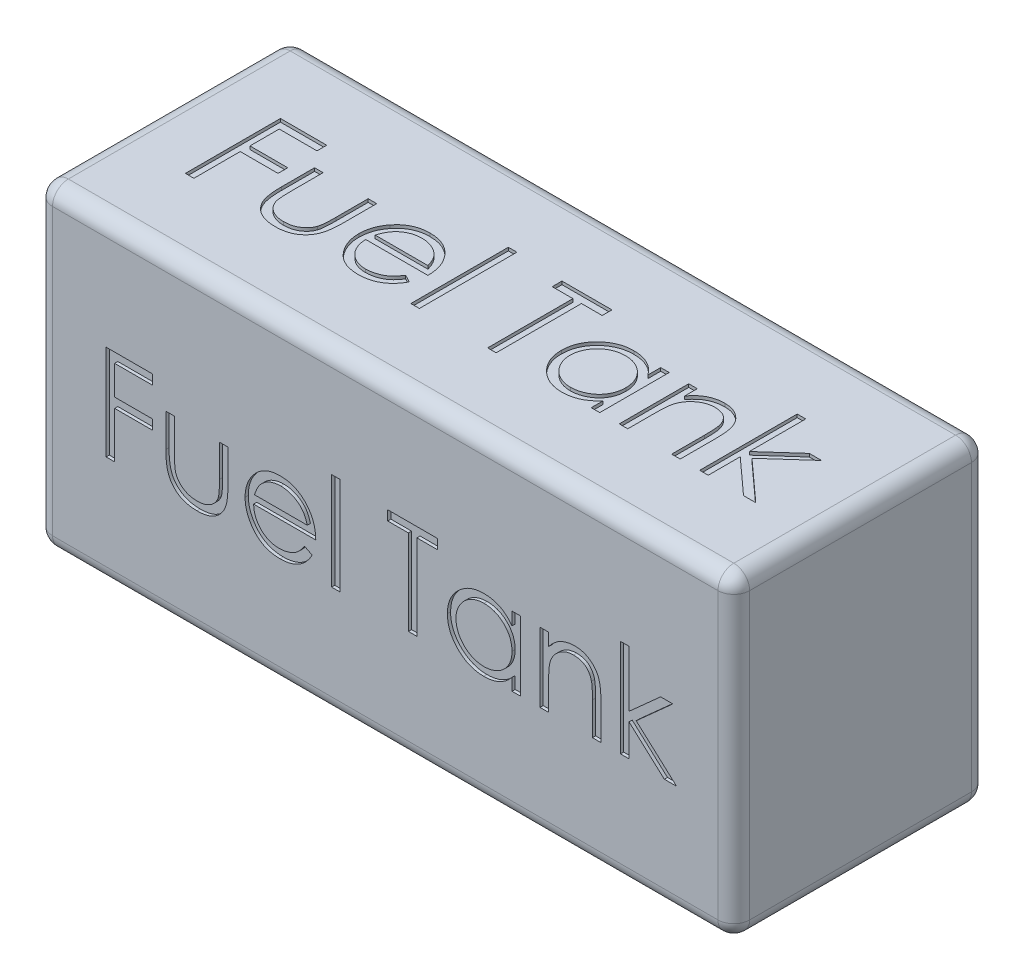
from build123d import *

# Parameters (mm, degrees)
SKETCH2_W           = 220
SKETCH2_H           = 80
BOSS_EXTRUDE1_DEPTH = 50
SKETCH3_W           = 2.692307692
SKETCH3_H           = 30.769230769
CUT_EXTRUDE1_DEPTH  = 1
SKETCH4_W           = 2.692307692
SKETCH4_H           = 30.769230769
CUT_EXTRUDE2_DEPTH  = 1
SKETCH5_W           = 2.692307692
SKETCH5_H           = 30.769230769
CUT_EXTRUDE3_DEPTH  = 1
FILLET1_R           = 5


with BuildPart() as part:
    # Sketch2 → Boss-Extrude1 (new, symmetric)
    with BuildSketch(Plane(origin=(0, 0, 0), x_dir=(1, 0, 0), z_dir=(0, 1, 0))):
        Rectangle(SKETCH2_W, SKETCH2_H)
    extrude(amount=BOSS_EXTRUDE1_DEPTH, both=True)

    # Sketch3 → Cut-Extrude1 (cut)
    # profile 1 of 8: a face of its own
    with BuildSketch(Plane(origin=(0, 50, 0), x_dir=(1, 0, 0), z_dir=(0, 1, 0))):
        Polygon((-88.076923077, 15), (-73.461538462, 15), (-73.461538462, 11.923076923), (-85.384615385, 11.923076923), (-85.384615385, 2.692307692), (-73.461538462, 2.692307692), (-73.461538462, -0.384615385), (-85.384615385, -0.384615385), (-85.384615385, -15), (-88.076923077, -15), align=None)
    # profile 2 of 8: a face of its own
    with BuildSketch(Plane(origin=(0, 50, 0), x_dir=(1, 0, 0), z_dir=(0, 1, 0))):
        with BuildLine():
            Line((-69.230769231, 6.923076923), (-66.538461538, 6.923076923))
            Line((-66.538461538, 6.923076923), (-66.538461538, -3.245192308))
            add(Edge.make_bspline(
                [(-66.538461538, -3.245192308), (-66.537245211, -3.543673015), (-66.534918433, -4.114652627), (-66.519138939, -4.936268513), (-66.482023851, -5.685554622), (-66.435619641, -6.362943794), (-66.375944188, -6.968321436), (-66.304943955, -7.499573068), (-66.225586056, -7.962723217), (-66.14790565, -8.241666266), (-66.111778846, -8.371394231)],
                knots=[0, 0, 0, 0, 1.388932606, 2.656963016, 3.823490214, 4.879454478, 5.816252168, 6.653371382, 7.373723809, 8, 8, 8, 8], degree=3))
            add(Edge.make_bspline(
                [(-66.111778846, -8.371394231), (-66.053823517, -8.534447411), (-65.939117737, -8.857163934), (-65.731059305, -9.323355407), (-65.473673563, -9.755143542), (-65.192017896, -10.169178451), (-64.86716583, -10.553195482), (-64.503227506, -10.906546142), (-64.112385475, -11.242581209), (-63.531628132, -11.640165141), (-62.737405852, -12.066296542), (-61.694667949, -12.433974985), (-60.564060299, -12.653710585), (-59.782648419, -12.6792042), (-59.381009615, -12.692307692)],
                knots=[0, 0, 0, 0, 0.725840625, 1.436591201, 2.137033971, 2.831655856, 3.53531722, 4.242432219, 4.957935707, 5.694543706, 7.190802206, 8.724350549, 10.316345118, 12, 12, 12, 12], degree=3))
            add(Edge.make_bspline(
                [(-59.381009615, -12.692307692), (-58.979408121, -12.678925561), (-58.202383535, -12.653033614), (-57.084198084, -12.440603283), (-56.062043103, -12.085697378), (-55.146177807, -11.590205277), (-54.340756319, -10.983844738), (-53.669575587, -10.272340663), (-53.11579912, -9.478203061), (-52.874004086, -8.885709243), (-52.752403846, -8.587740385)],
                knots=[0, 0, 0, 0, 1.157059328, 2.238695713, 3.266970494, 4.264342957, 5.228770407, 6.160125903, 7.074715775, 8, 8, 8, 8], degree=3))
            add(Edge.make_bspline(
                [(-52.752403846, -8.587740385), (-52.716453303, -8.468029253), (-52.636975431, -8.203377178), (-52.551583847, -7.754407906), (-52.47465989, -7.21899701), (-52.408975523, -6.593640936), (-52.362131272, -5.879973915), (-52.336879616, -5.078218976), (-52.308351543, -4.190893032), (-52.307918546, -3.569740809), (-52.307692308, -3.245192308)],
                knots=[0, 0, 0, 0, 0.557542046, 1.232589297, 2.036731608, 2.971723315, 4.038036528, 5.22795436, 6.551621927, 8, 8, 8, 8], degree=3))
            Line((-52.307692308, -3.245192308), (-52.307692308, 6.923076923))
            Line((-52.307692308, 6.923076923), (-49.615384615, 6.923076923))
            Line((-49.615384615, 6.923076923), (-49.615384615, -3.75))
            add(Edge.make_bspline(
                [(-49.615384615, -3.75), (-49.619170571, -4.112632898), (-49.626515843, -4.816190326), (-49.673721644, -5.838625567), (-49.754718324, -6.791444809), (-49.877655624, -7.675152408), (-50.022218549, -8.48907368), (-50.208700889, -9.234251788), (-50.431371498, -9.908390822), (-50.682561626, -10.523320338), (-50.979320491, -11.080865146), (-51.294980667, -11.610029288), (-51.659478711, -12.097683018), (-52.043223576, -12.568101337), (-52.470094912, -12.997885858), (-52.932093703, -13.396898508), (-53.422717302, -13.77123878), (-53.952853285, -14.106306889), (-54.514762395, -14.408163849), (-55.109138313, -14.675730233), (-55.743261155, -14.887466608), (-56.408949471, -15.070129457), (-57.109464723, -15.213396336), (-57.844131578, -15.314424051), (-58.612702574, -15.376355458), (-59.136497943, -15.381815843), (-59.405048077, -15.384615385)],
                knots=[0, 0, 0, 0, 1.493040784, 2.896703357, 4.213163133, 5.428574705, 6.569057535, 7.615249723, 8.588095153, 9.490268104, 10.346124644, 11.18633936, 12.024365274, 12.850166724, 13.684164916, 14.514361689, 15.362232829, 16.222528818, 17.093394965, 17.986930858, 18.902426812, 19.842810585, 20.827885679, 21.843828298, 22.894529745, 24, 24, 24, 24], degree=3))
            add(Edge.make_bspline(
                [(-59.405048077, -15.384615385), (-59.671589626, -15.381703609), (-60.195368584, -15.375981699), (-60.963979249, -15.314766205), (-61.700681589, -15.213553313), (-62.402856433, -15.069080021), (-63.07120841, -14.888745136), (-63.708444752, -14.674429118), (-64.307103864, -14.408024989), (-64.874378184, -14.108217353), (-65.405827225, -13.769086421), (-65.903900752, -13.397360367), (-66.367930916, -12.993594112), (-66.798020071, -12.559473908), (-67.188131299, -12.089614454), (-67.543125942, -11.587795365), (-67.868469129, -11.058988892), (-68.162921617, -10.492733214), (-68.415879522, -9.870687415), (-68.639210201, -9.182426583), (-68.821872816, -8.420405011), (-68.970522545, -7.585274195), (-69.090106321, -6.681030981), (-69.173130398, -5.702444565), (-69.219551804, -4.651898632), (-69.226949473, -3.926328146), (-69.230769231, -3.551682692)],
                knots=[0, 0, 0, 0, 1.083640291, 2.129454052, 3.13281866, 4.105697902, 5.042300162, 5.946461698, 6.836384745, 7.703652036, 8.553297018, 9.397182691, 10.228592656, 11.052265423, 11.879314572, 12.708807002, 13.549817954, 14.402308542, 15.300838682, 16.27712199, 17.341985831, 18.484375296, 19.725102775, 21.0496083, 22.476576903, 24, 24, 24, 24], degree=3))
            Line((-69.230769231, -3.551682692), (-69.230769231, 6.923076923))
        make_face()
    # profile 3 of 8: a face of its own
    with BuildSketch(Plane(origin=(0, 50, 0), x_dir=(1, 0, 0), z_dir=(0, 1, 0))):
        with BuildLine():
            Line((-25.46875, -8.076923077), (-23.076923077, -9.332932692))
            add(Edge.make_bspline(
                [(-23.076923077, -9.332932692), (-23.267522465, -9.671018389), (-23.638353395, -10.32879927), (-24.276074091, -11.232500931), (-24.94457757, -12.045481353), (-25.674040153, -12.746021247), (-26.442637401, -13.356747404), (-27.254631585, -13.891071616), (-28.114250023, -14.346373219), (-29.021533378, -14.729966315), (-29.984100959, -15.024904836), (-31.004285386, -15.233226729), (-32.08404106, -15.361997603), (-32.824151173, -15.376955953), (-33.203125, -15.384615385)],
                knots=[0, 0, 0, 0, 1.120438281, 2.179929193, 3.190490725, 4.156257408, 5.095198341, 6.022838206, 6.959905092, 7.901321166, 8.864066838, 9.862729781, 10.905609505, 12, 12, 12, 12], degree=3))
            add(Edge.make_bspline(
                [(-33.203125, -15.384615385), (-33.62434195, -15.374782453), (-34.446014193, -15.355601253), (-35.642069168, -15.190237272), (-36.768178469, -14.920474197), (-37.824278783, -14.543626699), (-38.807783805, -14.051392492), (-39.720648275, -13.451739791), (-40.567672783, -12.747749037), (-41.322166004, -11.933322378), (-42.001399285, -11.061762744), (-42.600763456, -10.153569449), (-43.101827151, -9.211027525), (-43.509420952, -8.240137319), (-43.838605509, -7.247018231), (-44.068034399, -6.222634223), (-44.200289381, -5.169757787), (-44.220556057, -4.457494909), (-44.230769231, -4.098557692)],
                knots=[0, 0, 0, 0, 1.145258523, 2.234067595, 3.276747158, 4.290159414, 5.277019952, 6.260822364, 7.254936242, 8.264827045, 9.274100331, 10.257902744, 11.220704747, 12.172965371, 13.118907548, 14.062713208, 15.023725156, 16, 16, 16, 16], degree=3))
            add(Edge.make_bspline(
                [(-44.230769231, -4.098557692), (-44.221690877, -3.76174486), (-44.203698777, -3.094226306), (-44.090292028, -2.106235924), (-43.889306659, -1.145992045), (-43.613509597, -0.212696777), (-43.257356058, 0.692087229), (-42.821651322, 1.568910631), (-42.305716655, 2.416840401), (-41.907379451, 2.951724405), (-41.706730769, 3.221153846)],
                knots=[0, 0, 0, 0, 1.024358464, 2.0301432, 3.019427413, 4.004406732, 4.986367066, 5.972626655, 6.978780325, 8, 8, 8, 8], degree=3))
            add(Edge.make_bspline(
                [(-41.706730769, 3.221153846), (-41.434950631, 3.545744161), (-40.89999966, 4.184642594), (-39.9952309, 5.024113957), (-39.015514931, 5.727346316), (-37.973129565, 6.310264626), (-36.855959787, 6.7531816), (-35.679023007, 7.083246591), (-34.428917982, 7.268200971), (-33.574301803, 7.294325259), (-33.137019231, 7.307692308)],
                knots=[0, 0, 0, 0, 1.030682036, 2.02871468, 2.997146059, 3.962720338, 4.930598197, 5.918074684, 6.934738563, 8, 8, 8, 8], degree=3))
            add(Edge.make_bspline(
                [(-33.137019231, 7.307692308), (-32.687468328, 7.296086174), (-31.805551934, 7.273317586), (-30.519562326, 7.062234729), (-29.302756184, 6.727498547), (-28.155620433, 6.254751771), (-27.078038769, 5.644812756), (-26.077015487, 4.889311257), (-25.135431094, 4.011441938), (-24.587643275, 3.336328714), (-24.308894231, 2.992788462)],
                knots=[0, 0, 0, 0, 1.056321875, 2.072262726, 3.055038591, 4.01806755, 4.982017516, 5.957941055, 6.960871419, 8, 8, 8, 8], degree=3))
            add(Edge.make_bspline(
                [(-24.308894231, 2.992788462), (-24.11923476, 2.733900621), (-23.741178247, 2.217848175), (-23.267631676, 1.376381114), (-22.85656829, 0.496004591), (-22.528000053, -0.437512241), (-22.261947185, -1.413108642), (-22.069460168, -2.437759026), (-21.956577723, -3.511158266), (-21.934388888, -4.242528741), (-21.923076923, -4.615384615)],
                knots=[0, 0, 0, 0, 0.94817472, 1.890038105, 2.849395472, 3.817997239, 4.812318967, 5.836947057, 6.897266129, 8, 8, 8, 8], degree=3))
            Line((-21.923076923, -4.615384615), (-41.538461538, -4.615384615))
            add(Edge.make_bspline(
                [(-41.538461538, -4.615384615), (-41.525264912, -4.904245738), (-41.499314278, -5.472279484), (-41.378327337, -6.303457625), (-41.187623561, -7.095229129), (-40.919603025, -7.841655203), (-40.595030065, -8.552484867), (-40.197438207, -9.222445184), (-39.723099173, -9.848484585), (-39.19402175, -10.436202907), (-38.60510379, -10.95958086), (-37.985537385, -11.428024656), (-37.326449685, -11.820644057), (-36.633037541, -12.139328826), (-35.90642224, -12.388811535), (-35.146374853, -12.559107141), (-34.354390999, -12.673168057), (-33.814513278, -12.685850901), (-33.539663462, -12.692307692)],
                knots=[0, 0, 0, 0, 1.094153842, 2.151609401, 3.174256925, 4.172055639, 5.149267565, 6.128595816, 7.11444997, 8.118368179, 9.117203808, 10.09244225, 11.054858984, 12.015122123, 12.976791628, 13.957293641, 14.960065497, 16, 16, 16, 16], degree=3))
            add(Edge.make_bspline(
                [(-33.539663462, -12.692307692), (-33.270939339, -12.687095778), (-32.737739131, -12.67675434), (-31.94367464, -12.576195104), (-31.162478691, -12.413592742), (-30.397384548, -12.191678541), (-29.663920155, -11.921019809), (-28.984672583, -11.594423886), (-28.35998502, -11.233140342), (-27.776125307, -10.819914556), (-27.209802507, -10.314130096), (-26.648009766, -9.682966773), (-26.045638451, -8.93650225), (-25.668584799, -8.374682255), (-25.46875, -8.076923077)],
                knots=[0, 0, 0, 0, 0.99110716, 1.966546729, 2.947904876, 3.932708344, 4.903319531, 5.828989031, 6.710028674, 7.56322171, 8.463672341, 9.504779593, 10.677557249, 12, 12, 12, 12], degree=3))
        make_face()
        with BuildLine():
            add(Edge.make_bspline(
                [(-24.615384615, -1.923076923), (-24.713927112, -1.565966577), (-24.903589696, -0.878644115), (-25.299901391, 0.073134946), (-25.746228883, 0.919031241), (-26.274415152, 1.652570952), (-26.872861371, 2.304029635), (-27.564105794, 2.873331794), (-28.339270595, 3.382624231), (-29.194348944, 3.812502798), (-30.099849959, 4.178415873), (-31.047903033, 4.423774008), (-32.0152555, 4.591855799), (-32.669549383, 4.607508157), (-32.998798077, 4.615384615)],
                knots=[0, 0, 0, 0, 1.154881502, 2.222775134, 3.210006277, 4.132804581, 5.035138423, 5.962687519, 6.919655026, 7.923214229, 8.944639381, 9.960483929, 10.97369054, 12, 12, 12, 12], degree=3))
            add(Edge.make_bspline(
                [(-32.998798077, 4.615384615), (-33.26750755, 4.610141716), (-33.798689685, 4.599777607), (-34.581270269, 4.501462213), (-35.332810546, 4.338949257), (-36.058855868, 4.116392486), (-36.749891883, 3.819747322), (-37.420132753, 3.471891094), (-38.052536149, 3.047248947), (-38.448032968, 2.72360162), (-38.647836538, 2.560096154)],
                knots=[0, 0, 0, 0, 1.04873581, 2.073130211, 3.073294108, 4.04793562, 5.032784715, 6.005352987, 6.992311501, 8, 8, 8, 8], degree=3))
            add(Edge.make_bspline(
                [(-38.647836538, 2.560096154), (-38.790921812, 2.430716306), (-39.080491534, 2.168883025), (-39.46741029, 1.71777554), (-39.837871484, 1.231333579), (-40.175017079, 0.690946797), (-40.484253535, 0.102768691), (-40.773624768, -0.528239611), (-41.034079729, -1.206866442), (-41.180617815, -1.679773064), (-41.256009615, -1.923076923)],
                knots=[0, 0, 0, 0, 0.879870761, 1.780643979, 2.707998968, 3.669668524, 4.684282772, 5.740141944, 6.837334558, 8, 8, 8, 8], degree=3))
            Line((-41.256009615, -1.923076923), (-24.615384615, -1.923076923))
        make_face(mode=Mode.SUBTRACT)
    # profile 4 of 8: a face of its own
    with BuildSketch(Plane(origin=(0, 50, 0), x_dir=(1, 0, 0), z_dir=(0, 1, 0))):
        with Locations((-15.576923077, 0.384615384)):
            Rectangle(SKETCH3_W, SKETCH3_H)
    # profile 5 of 8: a face of its own
    with BuildSketch(Plane(origin=(0, 50, 0), x_dir=(1, 0, 0), z_dir=(0, 1, 0))):
        Polygon((0.769230769, 11.923076923), (0.769230769, 15), (16.538461538, 15), (16.538461538, 11.923076923), (10, 11.923076923), (10, -15), (7.307692308, -15), (7.307692308, 11.923076923), align=None)
    # profile 6 of 8: a face of its own
    with BuildSketch(Plane(origin=(0, 50, 0), x_dir=(1, 0, 0), z_dir=(0, 1, 0))):
        with BuildLine():
            Line((42.692307692, 6.923076923), (42.692307692, -15))
            Line((42.692307692, -15), (40, -15))
            Line((40, -15), (40, -11.207932692))
            add(Edge.make_bspline(
                [(40, -11.207932692), (39.696410366, -11.551129212), (39.103951378, -12.220881536), (38.114456081, -13.095871585), (37.065585985, -13.819114342), (35.962431804, -14.403256476), (34.805989718, -14.84204553), (33.598823255, -15.153926894), (32.340439991, -15.354445482), (31.481134093, -15.374468526), (31.045673077, -15.384615385)],
                knots=[0, 0, 0, 0, 1.074387032, 2.096679803, 3.090159297, 4.057316773, 5.018401886, 5.985159533, 6.978961417, 8, 8, 8, 8], degree=3))
            add(Edge.make_bspline(
                [(31.045673077, -15.384615385), (30.658519187, -15.374103622), (29.895034574, -15.353373962), (28.771928198, -15.192554216), (27.691137489, -14.934291745), (26.651641151, -14.575141264), (25.660165619, -14.098734221), (24.708221933, -13.528380666), (23.800741716, -12.849173551), (22.951557096, -12.072704737), (22.169568522, -11.229319133), (21.483329042, -10.329785874), (20.911159786, -9.377994697), (20.432701952, -8.385996236), (20.064161856, -7.346154068), (19.807244991, -6.262064057), (19.646612591, -5.135007998), (19.625891499, -4.367526372), (19.615384615, -3.978365385)],
                knots=[0, 0, 0, 0, 1.033919861, 2.038935746, 3.024066025, 3.998881131, 4.97069526, 5.957263378, 6.95902576, 7.993208707, 9.027059324, 10.027763471, 11.009749337, 11.988697705, 12.965288445, 13.950418724, 14.960734635, 16, 16, 16, 16], degree=3))
            add(Edge.make_bspline(
                [(19.615384615, -3.978365385), (19.62612437, -3.597247925), (19.647356286, -2.843799268), (19.805526742, -1.735696143), (20.071506816, -0.668396765), (20.444774082, 0.354662748), (20.92341941, 1.334720321), (21.505660156, 2.272469107), (22.191538367, 3.170492514), (22.982273285, 4.007674458), (23.838857029, 4.780994009), (24.75521758, 5.453071541), (25.708559991, 6.033501674), (26.71367151, 6.493388613), (27.755675265, 6.865466652), (28.843847657, 7.122892093), (29.973661189, 7.274583418), (30.740722549, 7.296549968), (31.129807692, 7.307692308)],
                knots=[0, 0, 0, 0, 1.020392517, 2.01726096, 2.990465484, 3.961182959, 4.928053699, 5.906110375, 6.912531644, 7.948652711, 8.985773172, 9.998621852, 10.987621588, 11.969261332, 12.953316658, 13.946091881, 14.958173133, 16, 16, 16, 16], degree=3))
            add(Edge.make_bspline(
                [(31.129807692, 7.307692308), (31.577235056, 7.295368723), (32.454618998, 7.271202755), (33.738001935, 7.070093664), (34.95209746, 6.730335374), (36.10627762, 6.268185391), (37.196397787, 5.654053427), (38.212137652, 4.879368047), (39.164127509, 3.949015016), (39.71595858, 3.234411206), (40, 2.866586538)],
                knots=[0, 0, 0, 0, 1.038897134, 2.037228247, 3.008116434, 3.962042015, 4.918381754, 5.904844433, 6.921570401, 8, 8, 8, 8], degree=3))
            Line((40, 2.866586538), (40, 6.923076923))
            Line((40, 6.923076923), (42.692307692, 6.923076923))
        make_face()
        with BuildLine():
            add(Edge.make_bspline(
                [(31.165865385, 4.615384615), (30.772313917, 4.601382006), (29.995505917, 4.573743083), (28.855128757, 4.357970267), (27.763870922, 3.998959458), (26.727190285, 3.507971734), (25.761462714, 2.890582563), (24.898374107, 2.143827849), (24.130865238, 1.288082014), (23.485365831, 0.327206782), (22.959161571, -0.702891142), (22.58915844, -1.77967204), (22.34513632, -2.883714705), (22.320206144, -3.632537726), (22.307692308, -4.008413462)],
                knots=[0, 0, 0, 0, 1.031046209, 2.035121221, 3.029706178, 4.034933723, 5.034054252, 6.02443088, 7.017295772, 8.038157696, 9.050218397, 10.03989886, 11.016116709, 12, 12, 12, 12], degree=3))
            add(Edge.make_bspline(
                [(22.307692308, -4.008413462), (22.323677107, -4.382042952), (22.355584052, -5.127837431), (22.584875718, -6.233385231), (22.969560348, -7.310419878), (23.494492314, -8.349799822), (24.15180624, -9.314806397), (24.913708976, -10.18686459), (25.787568531, -10.936775347), (26.755518591, -11.564525978), (27.789301195, -12.0716333), (28.876449179, -12.424481638), (29.996526077, -12.652291186), (30.75811751, -12.678900988), (31.141826923, -12.692307692)],
                knots=[0, 0, 0, 0, 0.979072187, 1.954306742, 2.945804271, 3.96968567, 4.997920485, 5.998718438, 6.996577872, 8.005894225, 9.015743152, 10.005417472, 10.995077863, 12, 12, 12, 12], degree=3))
            add(Edge.make_bspline(
                [(31.141826923, -12.692307692), (31.531368375, -12.67807943), (32.306127688, -12.649780828), (33.449888042, -12.433084268), (34.559844866, -12.075065996), (35.620878252, -11.578787767), (36.609302233, -10.963724717), (37.496426898, -10.243663937), (38.24656377, -9.406208073), (38.882500424, -8.485838475), (39.381146852, -7.476878505), (39.744370217, -6.402585442), (39.959117981, -5.262921886), (39.986184235, -4.484088227), (40, -4.086538462)],
                knots=[0, 0, 0, 0, 1.01762866, 2.023962475, 3.030623092, 4.058876274, 5.077231937, 6.066672613, 7.034107872, 8.005628644, 8.981990164, 9.965428785, 10.961468474, 12, 12, 12, 12], degree=3))
            add(Edge.make_bspline(
                [(40, -4.086538462), (39.991774374, -3.783642771), (39.975583739, -3.1874482), (39.851893143, -2.312069478), (39.655136631, -1.474351826), (39.377883745, -0.673414491), (39.013672736, 0.086314212), (38.574406171, 0.8102893), (38.052359459, 1.494745397), (37.455936349, 2.130257434), (36.803091756, 2.709912825), (36.112281408, 3.227320602), (35.37532072, 3.652367226), (34.60460326, 4.004149553), (33.798791822, 4.284085124), (32.951329367, 4.470836784), (32.071223764, 4.599068108), (31.470829004, 4.609888514), (31.165865385, 4.615384615)],
                knots=[0, 0, 0, 0, 1.050140795, 2.067009409, 3.05949893, 4.030605086, 5.00011959, 5.97591094, 6.962425594, 7.979863591, 8.993523472, 9.986985069, 10.967611495, 11.937549037, 12.921786183, 13.919465291, 14.943216303, 16, 16, 16, 16], degree=3))
        make_face(mode=Mode.SUBTRACT)
    # profile 7 of 8: a face of its own
    with BuildSketch(Plane(origin=(0, 50, 0), x_dir=(1, 0, 0), z_dir=(0, 1, 0))):
        with BuildLine():
            Line((48.846153846, 6.923076923), (51.538461538, 6.923076923))
            Line((51.538461538, 6.923076923), (51.538461538, 2.96875))
            add(Edge.make_bspline(
                [(51.538461538, 2.96875), (51.825926982, 3.32740191), (52.383763706, 4.023378454), (53.312772277, 4.938126236), (54.294577137, 5.691942451), (55.323165738, 6.292832113), (56.399934396, 6.745803195), (57.518319567, 7.072939747), (58.685017048, 7.26909542), (59.478426507, 7.294725965), (59.879807692, 7.307692308)],
                knots=[0, 0, 0, 0, 1.12780773, 2.188550248, 3.19190651, 4.159438251, 5.104880172, 6.052711206, 7.014878035, 8, 8, 8, 8], degree=3))
            add(Edge.make_bspline(
                [(59.879807692, 7.307692308), (60.285498842, 7.29273349), (61.07953428, 7.263455474), (62.235631949, 7.031883836), (63.315403895, 6.636353078), (64.315000087, 6.094535332), (65.216090487, 5.42076556), (66.007446357, 4.635813145), (66.661988478, 3.732932431), (67.100823018, 2.895305378), (67.389899998, 2.15225857), (67.571891462, 1.515857855), (67.726442732, 0.80684513), (67.860429143, 0.027362938), (67.951090102, -0.828050121), (68.022595458, -1.755887481), (68.073841409, -2.7558486), (68.075874612, -3.447448263), (68.076923077, -3.804086538)],
                knots=[0, 0, 0, 0, 1.235846778, 2.418850247, 3.575807741, 4.728682307, 5.871620074, 6.994088408, 8.11269785, 9.256955736, 9.865816715, 10.540099792, 11.271859618, 12.076849838, 12.949306005, 13.892391288, 14.913166135, 16, 16, 16, 16], degree=3))
            Line((68.076923077, -3.804086538), (68.076923077, -15))
            Line((68.076923077, -15), (65.384615385, -15))
            Line((65.384615385, -15), (65.384615385, -4.6875))
            add(Edge.make_bspline(
                [(65.384615385, -4.6875), (65.382959316, -4.389021901), (65.379791538, -3.818084094), (65.369800281, -3.000635324), (65.345716224, -2.259321795), (65.311873542, -1.595915788), (65.262338995, -1.011054332), (65.21071644, -0.503546246), (65.147588068, -0.074035882), (65.091334527, 0.184521967), (65.066105769, 0.300480769)],
                knots=[0, 0, 0, 0, 1.430800155, 2.736877192, 3.918605307, 4.986035426, 5.920637409, 6.731861385, 7.431261377, 8, 8, 8, 8], degree=3))
            add(Edge.make_bspline(
                [(65.066105769, 0.300480769), (64.975029785, 0.640862354), (64.799736693, 1.295991594), (64.366588267, 2.184628902), (63.819609574, 2.940613369), (63.151913722, 3.559270983), (62.369950217, 4.040735298), (61.475888993, 4.374797767), (60.478357787, 4.583737217), (59.776748793, 4.604541206), (59.411057692, 4.615384615)],
                knots=[0, 0, 0, 0, 1.084156227, 2.086665306, 3.027808233, 3.945421172, 4.874247719, 5.839848303, 6.874090471, 8, 8, 8, 8], degree=3))
            add(Edge.make_bspline(
                [(59.411057692, 4.615384615), (59.194477547, 4.611304575), (58.765871036, 4.603230282), (58.130299848, 4.522219156), (57.513806935, 4.389718108), (56.910205144, 4.210844072), (56.331566912, 3.965167479), (55.759301559, 3.686344305), (55.214957866, 3.338788203), (54.686928748, 2.951440019), (54.195676111, 2.522189672), (53.738576067, 2.069236727), (53.331107322, 1.586874409), (52.961947248, 1.082874859), (52.643276419, 0.550316247), (52.365107093, -0.005663522), (52.129086852, -0.585796227), (52.011806631, -0.988439609), (51.953125, -1.189903846)],
                knots=[0, 0, 0, 0, 1.023777757, 2.026029729, 3.023749952, 4.003683103, 4.997618607, 5.993177895, 7.010360494, 8.046726602, 9.087585522, 10.09234134, 11.086953743, 12.070360549, 13.043493632, 14.017870808, 15.008233677, 16, 16, 16, 16], degree=3))
            add(Edge.make_bspline(
                [(51.953125, -1.189903846), (51.919356584, -1.337805587), (51.845844508, -1.659779939), (51.766445823, -2.188160676), (51.694380891, -2.799389033), (51.634064103, -3.492751751), (51.597160533, -4.270676395), (51.556922847, -5.129840719), (51.542273752, -6.073670619), (51.53976786, -6.730770842), (51.538461538, -7.073317308)],
                knots=[0, 0, 0, 0, 0.615963638, 1.340920617, 2.168419149, 3.115676021, 4.16674242, 5.331190069, 6.6087489, 8, 8, 8, 8], degree=3))
            Line((51.538461538, -7.073317308), (51.538461538, -15))
            Line((51.538461538, -15), (48.846153846, -15))
            Line((48.846153846, -15), (48.846153846, 6.923076923))
        make_face()
    # profile 8 of 8: a face of its own
    with BuildSketch(Plane(origin=(0, 50, 0), x_dir=(1, 0, 0), z_dir=(0, 1, 0))):
        Polygon((74.230769231, 15.769230769), (76.923076923, 15.769230769), (76.923076923, -2.019230769), (86.899038462, 6.923076923), (90.769230769, 6.923076923), (79.194711538, -3.461538462), (91.923076923, -15), (88.058894231, -15), (76.923076923, -4.897836538), (76.923076923, -15), (74.230769231, -15), align=None)
    extrude(amount=-CUT_EXTRUDE1_DEPTH, mode=Mode.SUBTRACT)

    # Sketch4 → Cut-Extrude2 (cut)
    # profile 1 of 8: a face of its own
    with BuildSketch(Plane(origin=(0, 0, -40), x_dir=(-1, 0, 0), z_dir=(0, 0, -1))):
        Polygon((-88.076923077, 15), (-73.461538462, 15), (-73.461538462, 11.923076923), (-85.384615385, 11.923076923), (-85.384615385, 2.692307692), (-73.461538462, 2.692307692), (-73.461538462, -0.384615385), (-85.384615385, -0.384615385), (-85.384615385, -15), (-88.076923077, -15), align=None)
    # profile 2 of 8: a face of its own
    with BuildSketch(Plane(origin=(0, 0, -40), x_dir=(-1, 0, 0), z_dir=(0, 0, -1))):
        with BuildLine():
            Line((-69.230769231, 6.923076923), (-66.538461538, 6.923076923))
            Line((-66.538461538, 6.923076923), (-66.538461538, -3.245192308))
            add(Edge.make_bspline(
                [(-66.538461538, -3.245192308), (-66.537245211, -3.543673015), (-66.534918433, -4.114652627), (-66.519138939, -4.936268513), (-66.482023851, -5.685554622), (-66.435619641, -6.362943794), (-66.375944188, -6.968321436), (-66.304943955, -7.499573068), (-66.225586056, -7.962723217), (-66.14790565, -8.241666266), (-66.111778846, -8.371394231)],
                knots=[0, 0, 0, 0, 1.388932606, 2.656963016, 3.823490214, 4.879454478, 5.816252168, 6.653371382, 7.373723809, 8, 8, 8, 8], degree=3))
            add(Edge.make_bspline(
                [(-66.111778846, -8.371394231), (-66.053823517, -8.534447411), (-65.939117737, -8.857163934), (-65.731059305, -9.323355407), (-65.473673563, -9.755143542), (-65.192017896, -10.169178451), (-64.86716583, -10.553195482), (-64.503227506, -10.906546142), (-64.112385475, -11.242581209), (-63.531628132, -11.640165141), (-62.737405852, -12.066296542), (-61.694667949, -12.433974985), (-60.564060299, -12.653710585), (-59.782648419, -12.6792042), (-59.381009615, -12.692307692)],
                knots=[0, 0, 0, 0, 0.725840625, 1.436591201, 2.137033971, 2.831655856, 3.53531722, 4.242432219, 4.957935707, 5.694543706, 7.190802206, 8.724350549, 10.316345118, 12, 12, 12, 12], degree=3))
            add(Edge.make_bspline(
                [(-59.381009615, -12.692307692), (-58.979408121, -12.678925561), (-58.202383535, -12.653033614), (-57.084198084, -12.440603283), (-56.062043103, -12.085697378), (-55.146177807, -11.590205277), (-54.340756319, -10.983844738), (-53.669575587, -10.272340663), (-53.11579912, -9.478203061), (-52.874004086, -8.885709243), (-52.752403846, -8.587740385)],
                knots=[0, 0, 0, 0, 1.157059328, 2.238695713, 3.266970494, 4.264342957, 5.228770407, 6.160125903, 7.074715775, 8, 8, 8, 8], degree=3))
            add(Edge.make_bspline(
                [(-52.752403846, -8.587740385), (-52.716453303, -8.468029253), (-52.636975431, -8.203377178), (-52.551583847, -7.754407906), (-52.47465989, -7.21899701), (-52.408975523, -6.593640936), (-52.362131272, -5.879973915), (-52.336879616, -5.078218976), (-52.308351543, -4.190893032), (-52.307918546, -3.569740809), (-52.307692308, -3.245192308)],
                knots=[0, 0, 0, 0, 0.557542046, 1.232589297, 2.036731608, 2.971723315, 4.038036528, 5.22795436, 6.551621927, 8, 8, 8, 8], degree=3))
            Line((-52.307692308, -3.245192308), (-52.307692308, 6.923076923))
            Line((-52.307692308, 6.923076923), (-49.615384615, 6.923076923))
            Line((-49.615384615, 6.923076923), (-49.615384615, -3.75))
            add(Edge.make_bspline(
                [(-49.615384615, -3.75), (-49.619170571, -4.112632898), (-49.626515843, -4.816190326), (-49.673721644, -5.838625567), (-49.754718324, -6.791444809), (-49.877655624, -7.675152408), (-50.022218549, -8.48907368), (-50.208700889, -9.234251788), (-50.431371498, -9.908390822), (-50.682561626, -10.523320338), (-50.979320491, -11.080865146), (-51.294980667, -11.610029288), (-51.659478711, -12.097683018), (-52.043223576, -12.568101337), (-52.470094912, -12.997885858), (-52.932093703, -13.396898508), (-53.422717302, -13.77123878), (-53.952853285, -14.106306889), (-54.514762395, -14.408163849), (-55.109138313, -14.675730233), (-55.743261155, -14.887466608), (-56.408949471, -15.070129457), (-57.109464723, -15.213396336), (-57.844131578, -15.314424051), (-58.612702574, -15.376355458), (-59.136497943, -15.381815843), (-59.405048077, -15.384615385)],
                knots=[0, 0, 0, 0, 1.493040784, 2.896703357, 4.213163133, 5.428574705, 6.569057535, 7.615249723, 8.588095153, 9.490268104, 10.346124644, 11.18633936, 12.024365274, 12.850166724, 13.684164916, 14.514361689, 15.362232829, 16.222528818, 17.093394965, 17.986930858, 18.902426812, 19.842810585, 20.827885679, 21.843828298, 22.894529745, 24, 24, 24, 24], degree=3))
            add(Edge.make_bspline(
                [(-59.405048077, -15.384615385), (-59.671589626, -15.381703609), (-60.195368584, -15.375981699), (-60.963979249, -15.314766205), (-61.700681589, -15.213553313), (-62.402856433, -15.069080021), (-63.07120841, -14.888745136), (-63.708444752, -14.674429118), (-64.307103864, -14.408024989), (-64.874378184, -14.108217353), (-65.405827225, -13.769086421), (-65.903900752, -13.397360367), (-66.367930916, -12.993594112), (-66.798020071, -12.559473908), (-67.188131299, -12.089614454), (-67.543125942, -11.587795365), (-67.868469129, -11.058988892), (-68.162921617, -10.492733214), (-68.415879522, -9.870687415), (-68.639210201, -9.182426583), (-68.821872816, -8.420405011), (-68.970522545, -7.585274195), (-69.090106321, -6.681030981), (-69.173130398, -5.702444565), (-69.219551804, -4.651898632), (-69.226949473, -3.926328146), (-69.230769231, -3.551682692)],
                knots=[0, 0, 0, 0, 1.083640291, 2.129454052, 3.13281866, 4.105697902, 5.042300162, 5.946461698, 6.836384745, 7.703652036, 8.553297018, 9.397182691, 10.228592656, 11.052265423, 11.879314572, 12.708807002, 13.549817954, 14.402308542, 15.300838682, 16.27712199, 17.341985831, 18.484375296, 19.725102775, 21.0496083, 22.476576903, 24, 24, 24, 24], degree=3))
            Line((-69.230769231, -3.551682692), (-69.230769231, 6.923076923))
        make_face()
    # profile 3 of 8: a face of its own
    with BuildSketch(Plane(origin=(0, 0, -40), x_dir=(-1, 0, 0), z_dir=(0, 0, -1))):
        with BuildLine():
            Line((-25.46875, -8.076923077), (-23.076923077, -9.332932692))
            add(Edge.make_bspline(
                [(-23.076923077, -9.332932692), (-23.267522465, -9.671018389), (-23.638353395, -10.32879927), (-24.276074091, -11.232500931), (-24.94457757, -12.045481353), (-25.674040153, -12.746021247), (-26.442637401, -13.356747404), (-27.254631585, -13.891071616), (-28.114250023, -14.346373219), (-29.021533378, -14.729966315), (-29.984100959, -15.024904836), (-31.004285386, -15.233226729), (-32.08404106, -15.361997603), (-32.824151173, -15.376955953), (-33.203125, -15.384615385)],
                knots=[0, 0, 0, 0, 1.120438281, 2.179929193, 3.190490725, 4.156257408, 5.095198341, 6.022838206, 6.959905092, 7.901321166, 8.864066838, 9.862729781, 10.905609505, 12, 12, 12, 12], degree=3))
            add(Edge.make_bspline(
                [(-33.203125, -15.384615385), (-33.62434195, -15.374782453), (-34.446014193, -15.355601253), (-35.642069168, -15.190237272), (-36.768178469, -14.920474197), (-37.824278783, -14.543626699), (-38.807783805, -14.051392492), (-39.720648275, -13.451739791), (-40.567672783, -12.747749037), (-41.322166004, -11.933322378), (-42.001399285, -11.061762744), (-42.600763456, -10.153569449), (-43.101827151, -9.211027525), (-43.509420952, -8.240137319), (-43.838605509, -7.247018231), (-44.068034399, -6.222634223), (-44.200289381, -5.169757787), (-44.220556057, -4.457494909), (-44.230769231, -4.098557692)],
                knots=[0, 0, 0, 0, 1.145258523, 2.234067595, 3.276747158, 4.290159414, 5.277019952, 6.260822364, 7.254936242, 8.264827045, 9.274100331, 10.257902744, 11.220704747, 12.172965371, 13.118907548, 14.062713208, 15.023725156, 16, 16, 16, 16], degree=3))
            add(Edge.make_bspline(
                [(-44.230769231, -4.098557692), (-44.221690877, -3.76174486), (-44.203698777, -3.094226306), (-44.090292028, -2.106235924), (-43.889306659, -1.145992045), (-43.613509597, -0.212696777), (-43.257356058, 0.692087229), (-42.821651322, 1.568910631), (-42.305716655, 2.416840401), (-41.907379451, 2.951724405), (-41.706730769, 3.221153846)],
                knots=[0, 0, 0, 0, 1.024358464, 2.0301432, 3.019427413, 4.004406732, 4.986367066, 5.972626655, 6.978780325, 8, 8, 8, 8], degree=3))
            add(Edge.make_bspline(
                [(-41.706730769, 3.221153846), (-41.434950631, 3.545744161), (-40.89999966, 4.184642594), (-39.9952309, 5.024113957), (-39.015514931, 5.727346316), (-37.973129565, 6.310264626), (-36.855959787, 6.7531816), (-35.679023007, 7.083246591), (-34.428917982, 7.268200971), (-33.574301803, 7.294325259), (-33.137019231, 7.307692308)],
                knots=[0, 0, 0, 0, 1.030682036, 2.02871468, 2.997146059, 3.962720338, 4.930598197, 5.918074684, 6.934738563, 8, 8, 8, 8], degree=3))
            add(Edge.make_bspline(
                [(-33.137019231, 7.307692308), (-32.687468328, 7.296086174), (-31.805551934, 7.273317586), (-30.519562326, 7.062234729), (-29.302756184, 6.727498547), (-28.155620433, 6.254751771), (-27.078038769, 5.644812756), (-26.077015487, 4.889311257), (-25.135431094, 4.011441938), (-24.587643275, 3.336328714), (-24.308894231, 2.992788462)],
                knots=[0, 0, 0, 0, 1.056321875, 2.072262726, 3.055038591, 4.01806755, 4.982017516, 5.957941055, 6.960871419, 8, 8, 8, 8], degree=3))
            add(Edge.make_bspline(
                [(-24.308894231, 2.992788462), (-24.11923476, 2.733900621), (-23.741178247, 2.217848175), (-23.267631676, 1.376381114), (-22.85656829, 0.496004591), (-22.528000053, -0.437512241), (-22.261947185, -1.413108642), (-22.069460168, -2.437759026), (-21.956577723, -3.511158266), (-21.934388888, -4.242528741), (-21.923076923, -4.615384615)],
                knots=[0, 0, 0, 0, 0.94817472, 1.890038105, 2.849395472, 3.817997239, 4.812318967, 5.836947057, 6.897266129, 8, 8, 8, 8], degree=3))
            Line((-21.923076923, -4.615384615), (-41.538461538, -4.615384615))
            add(Edge.make_bspline(
                [(-41.538461538, -4.615384615), (-41.525264912, -4.904245738), (-41.499314278, -5.472279484), (-41.378327337, -6.303457625), (-41.187623561, -7.095229129), (-40.919603025, -7.841655203), (-40.595030065, -8.552484867), (-40.197438207, -9.222445184), (-39.723099173, -9.848484585), (-39.19402175, -10.436202907), (-38.60510379, -10.95958086), (-37.985537385, -11.428024656), (-37.326449685, -11.820644057), (-36.633037541, -12.139328826), (-35.90642224, -12.388811535), (-35.146374853, -12.559107141), (-34.354390999, -12.673168057), (-33.814513278, -12.685850901), (-33.539663462, -12.692307692)],
                knots=[0, 0, 0, 0, 1.094153842, 2.151609401, 3.174256925, 4.172055639, 5.149267565, 6.128595816, 7.11444997, 8.118368179, 9.117203808, 10.09244225, 11.054858984, 12.015122123, 12.976791628, 13.957293641, 14.960065497, 16, 16, 16, 16], degree=3))
            add(Edge.make_bspline(
                [(-33.539663462, -12.692307692), (-33.270939339, -12.687095778), (-32.737739131, -12.67675434), (-31.94367464, -12.576195104), (-31.162478691, -12.413592742), (-30.397384548, -12.191678541), (-29.663920155, -11.921019809), (-28.984672583, -11.594423886), (-28.35998502, -11.233140342), (-27.776125307, -10.819914556), (-27.209802507, -10.314130096), (-26.648009766, -9.682966773), (-26.045638451, -8.93650225), (-25.668584799, -8.374682255), (-25.46875, -8.076923077)],
                knots=[0, 0, 0, 0, 0.99110716, 1.966546729, 2.947904876, 3.932708344, 4.903319531, 5.828989031, 6.710028674, 7.56322171, 8.463672341, 9.504779593, 10.677557249, 12, 12, 12, 12], degree=3))
        make_face()
        with BuildLine():
            add(Edge.make_bspline(
                [(-24.615384615, -1.923076923), (-24.713927112, -1.565966577), (-24.903589696, -0.878644115), (-25.299901391, 0.073134946), (-25.746228883, 0.919031241), (-26.274415152, 1.652570952), (-26.872861371, 2.304029635), (-27.564105794, 2.873331794), (-28.339270595, 3.382624231), (-29.194348944, 3.812502798), (-30.099849959, 4.178415873), (-31.047903033, 4.423774008), (-32.0152555, 4.591855799), (-32.669549383, 4.607508157), (-32.998798077, 4.615384615)],
                knots=[0, 0, 0, 0, 1.154881502, 2.222775134, 3.210006277, 4.132804581, 5.035138423, 5.962687519, 6.919655026, 7.923214229, 8.944639381, 9.960483929, 10.97369054, 12, 12, 12, 12], degree=3))
            add(Edge.make_bspline(
                [(-32.998798077, 4.615384615), (-33.26750755, 4.610141716), (-33.798689685, 4.599777607), (-34.581270269, 4.501462213), (-35.332810546, 4.338949257), (-36.058855868, 4.116392486), (-36.749891883, 3.819747322), (-37.420132753, 3.471891094), (-38.052536149, 3.047248947), (-38.448032968, 2.72360162), (-38.647836538, 2.560096154)],
                knots=[0, 0, 0, 0, 1.04873581, 2.073130211, 3.073294108, 4.04793562, 5.032784715, 6.005352987, 6.992311501, 8, 8, 8, 8], degree=3))
            add(Edge.make_bspline(
                [(-38.647836538, 2.560096154), (-38.790921812, 2.430716306), (-39.080491534, 2.168883025), (-39.46741029, 1.71777554), (-39.837871484, 1.231333579), (-40.175017079, 0.690946797), (-40.484253535, 0.102768691), (-40.773624768, -0.528239611), (-41.034079729, -1.206866442), (-41.180617815, -1.679773064), (-41.256009615, -1.923076923)],
                knots=[0, 0, 0, 0, 0.879870761, 1.780643979, 2.707998968, 3.669668524, 4.684282772, 5.740141944, 6.837334558, 8, 8, 8, 8], degree=3))
            Line((-41.256009615, -1.923076923), (-24.615384615, -1.923076923))
        make_face(mode=Mode.SUBTRACT)
    # profile 4 of 8: a face of its own
    with BuildSketch(Plane(origin=(0, 0, -40), x_dir=(-1, 0, 0), z_dir=(0, 0, -1))):
        with Locations((-15.576923077, 0.384615384)):
            Rectangle(SKETCH4_W, SKETCH4_H)
    # profile 5 of 8: a face of its own
    with BuildSketch(Plane(origin=(0, 0, -40), x_dir=(-1, 0, 0), z_dir=(0, 0, -1))):
        Polygon((0.769230769, 11.923076923), (0.769230769, 15), (16.538461538, 15), (16.538461538, 11.923076923), (10, 11.923076923), (10, -15), (7.307692308, -15), (7.307692308, 11.923076923), align=None)
    # profile 6 of 8: a face of its own
    with BuildSketch(Plane(origin=(0, 0, -40), x_dir=(-1, 0, 0), z_dir=(0, 0, -1))):
        with BuildLine():
            Line((42.692307692, 6.923076923), (42.692307692, -15))
            Line((42.692307692, -15), (40, -15))
            Line((40, -15), (40, -11.207932692))
            add(Edge.make_bspline(
                [(40, -11.207932692), (39.696410366, -11.551129212), (39.103951378, -12.220881536), (38.114456081, -13.095871585), (37.065585985, -13.819114342), (35.962431804, -14.403256476), (34.805989718, -14.84204553), (33.598823255, -15.153926894), (32.340439991, -15.354445482), (31.481134093, -15.374468526), (31.045673077, -15.384615385)],
                knots=[0, 0, 0, 0, 1.074387032, 2.096679803, 3.090159297, 4.057316773, 5.018401886, 5.985159533, 6.978961417, 8, 8, 8, 8], degree=3))
            add(Edge.make_bspline(
                [(31.045673077, -15.384615385), (30.658519187, -15.374103622), (29.895034574, -15.353373962), (28.771928198, -15.192554216), (27.691137489, -14.934291745), (26.651641151, -14.575141264), (25.660165619, -14.098734221), (24.708221933, -13.528380666), (23.800741716, -12.849173551), (22.951557096, -12.072704737), (22.169568522, -11.229319133), (21.483329042, -10.329785874), (20.911159786, -9.377994697), (20.432701952, -8.385996236), (20.064161856, -7.346154068), (19.807244991, -6.262064057), (19.646612591, -5.135007998), (19.625891499, -4.367526372), (19.615384615, -3.978365385)],
                knots=[0, 0, 0, 0, 1.033919861, 2.038935746, 3.024066025, 3.998881131, 4.97069526, 5.957263378, 6.95902576, 7.993208707, 9.027059324, 10.027763471, 11.009749337, 11.988697705, 12.965288445, 13.950418724, 14.960734635, 16, 16, 16, 16], degree=3))
            add(Edge.make_bspline(
                [(19.615384615, -3.978365385), (19.62612437, -3.597247925), (19.647356286, -2.843799268), (19.805526742, -1.735696143), (20.071506816, -0.668396765), (20.444774082, 0.354662748), (20.92341941, 1.334720321), (21.505660156, 2.272469107), (22.191538367, 3.170492514), (22.982273285, 4.007674458), (23.838857029, 4.780994009), (24.75521758, 5.453071541), (25.708559991, 6.033501674), (26.71367151, 6.493388613), (27.755675265, 6.865466652), (28.843847657, 7.122892093), (29.973661189, 7.274583418), (30.740722549, 7.296549968), (31.129807692, 7.307692308)],
                knots=[0, 0, 0, 0, 1.020392517, 2.01726096, 2.990465484, 3.961182959, 4.928053699, 5.906110375, 6.912531644, 7.948652711, 8.985773172, 9.998621852, 10.987621588, 11.969261332, 12.953316658, 13.946091881, 14.958173133, 16, 16, 16, 16], degree=3))
            add(Edge.make_bspline(
                [(31.129807692, 7.307692308), (31.577235056, 7.295368723), (32.454618998, 7.271202755), (33.738001935, 7.070093664), (34.95209746, 6.730335374), (36.10627762, 6.268185391), (37.196397787, 5.654053427), (38.212137652, 4.879368047), (39.164127509, 3.949015016), (39.71595858, 3.234411206), (40, 2.866586538)],
                knots=[0, 0, 0, 0, 1.038897134, 2.037228247, 3.008116434, 3.962042015, 4.918381754, 5.904844433, 6.921570401, 8, 8, 8, 8], degree=3))
            Line((40, 2.866586538), (40, 6.923076923))
            Line((40, 6.923076923), (42.692307692, 6.923076923))
        make_face()
        with BuildLine():
            add(Edge.make_bspline(
                [(31.165865385, 4.615384615), (30.772313917, 4.601382006), (29.995505917, 4.573743083), (28.855128757, 4.357970267), (27.763870922, 3.998959458), (26.727190285, 3.507971734), (25.761462714, 2.890582563), (24.898374107, 2.143827849), (24.130865238, 1.288082014), (23.485365831, 0.327206782), (22.959161571, -0.702891142), (22.58915844, -1.77967204), (22.34513632, -2.883714705), (22.320206144, -3.632537726), (22.307692308, -4.008413462)],
                knots=[0, 0, 0, 0, 1.031046209, 2.035121221, 3.029706178, 4.034933723, 5.034054252, 6.02443088, 7.017295772, 8.038157696, 9.050218397, 10.03989886, 11.016116709, 12, 12, 12, 12], degree=3))
            add(Edge.make_bspline(
                [(22.307692308, -4.008413462), (22.323677107, -4.382042952), (22.355584052, -5.127837431), (22.584875718, -6.233385231), (22.969560348, -7.310419878), (23.494492314, -8.349799822), (24.15180624, -9.314806397), (24.913708976, -10.18686459), (25.787568531, -10.936775347), (26.755518591, -11.564525978), (27.789301195, -12.0716333), (28.876449179, -12.424481638), (29.996526077, -12.652291186), (30.75811751, -12.678900988), (31.141826923, -12.692307692)],
                knots=[0, 0, 0, 0, 0.979072187, 1.954306742, 2.945804271, 3.96968567, 4.997920485, 5.998718438, 6.996577872, 8.005894225, 9.015743152, 10.005417472, 10.995077863, 12, 12, 12, 12], degree=3))
            add(Edge.make_bspline(
                [(31.141826923, -12.692307692), (31.531368375, -12.67807943), (32.306127688, -12.649780828), (33.449888042, -12.433084268), (34.559844866, -12.075065996), (35.620878252, -11.578787767), (36.609302233, -10.963724717), (37.496426898, -10.243663937), (38.24656377, -9.406208073), (38.882500424, -8.485838475), (39.381146852, -7.476878505), (39.744370217, -6.402585442), (39.959117981, -5.262921886), (39.986184235, -4.484088227), (40, -4.086538462)],
                knots=[0, 0, 0, 0, 1.01762866, 2.023962475, 3.030623092, 4.058876274, 5.077231937, 6.066672613, 7.034107872, 8.005628644, 8.981990164, 9.965428785, 10.961468474, 12, 12, 12, 12], degree=3))
            add(Edge.make_bspline(
                [(40, -4.086538462), (39.991774374, -3.783642771), (39.975583739, -3.1874482), (39.851893143, -2.312069478), (39.655136631, -1.474351826), (39.377883745, -0.673414491), (39.013672736, 0.086314212), (38.574406171, 0.8102893), (38.052359459, 1.494745397), (37.455936349, 2.130257434), (36.803091756, 2.709912825), (36.112281408, 3.227320602), (35.37532072, 3.652367226), (34.60460326, 4.004149553), (33.798791822, 4.284085124), (32.951329367, 4.470836784), (32.071223764, 4.599068108), (31.470829004, 4.609888514), (31.165865385, 4.615384615)],
                knots=[0, 0, 0, 0, 1.050140795, 2.067009409, 3.05949893, 4.030605086, 5.00011959, 5.97591094, 6.962425594, 7.979863591, 8.993523472, 9.986985069, 10.967611495, 11.937549037, 12.921786183, 13.919465291, 14.943216303, 16, 16, 16, 16], degree=3))
        make_face(mode=Mode.SUBTRACT)
    # profile 7 of 8: a face of its own
    with BuildSketch(Plane(origin=(0, 0, -40), x_dir=(-1, 0, 0), z_dir=(0, 0, -1))):
        with BuildLine():
            Line((48.846153846, 6.923076923), (51.538461538, 6.923076923))
            Line((51.538461538, 6.923076923), (51.538461538, 2.96875))
            add(Edge.make_bspline(
                [(51.538461538, 2.96875), (51.825926982, 3.32740191), (52.383763706, 4.023378454), (53.312772277, 4.938126236), (54.294577137, 5.691942451), (55.323165738, 6.292832113), (56.399934396, 6.745803195), (57.518319567, 7.072939747), (58.685017048, 7.26909542), (59.478426507, 7.294725965), (59.879807692, 7.307692308)],
                knots=[0, 0, 0, 0, 1.12780773, 2.188550248, 3.19190651, 4.159438251, 5.104880172, 6.052711206, 7.014878035, 8, 8, 8, 8], degree=3))
            add(Edge.make_bspline(
                [(59.879807692, 7.307692308), (60.285498842, 7.29273349), (61.07953428, 7.263455474), (62.235631949, 7.031883836), (63.315403895, 6.636353078), (64.315000087, 6.094535332), (65.216090487, 5.42076556), (66.007446357, 4.635813145), (66.661988478, 3.732932431), (67.100823018, 2.895305378), (67.389899998, 2.15225857), (67.571891462, 1.515857855), (67.726442732, 0.80684513), (67.860429143, 0.027362938), (67.951090102, -0.828050121), (68.022595458, -1.755887481), (68.073841409, -2.7558486), (68.075874612, -3.447448263), (68.076923077, -3.804086538)],
                knots=[0, 0, 0, 0, 1.235846778, 2.418850247, 3.575807741, 4.728682307, 5.871620074, 6.994088408, 8.11269785, 9.256955736, 9.865816715, 10.540099792, 11.271859618, 12.076849838, 12.949306005, 13.892391288, 14.913166135, 16, 16, 16, 16], degree=3))
            Line((68.076923077, -3.804086538), (68.076923077, -15))
            Line((68.076923077, -15), (65.384615385, -15))
            Line((65.384615385, -15), (65.384615385, -4.6875))
            add(Edge.make_bspline(
                [(65.384615385, -4.6875), (65.382959316, -4.389021901), (65.379791538, -3.818084094), (65.369800281, -3.000635324), (65.345716224, -2.259321795), (65.311873542, -1.595915788), (65.262338995, -1.011054332), (65.21071644, -0.503546246), (65.147588068, -0.074035882), (65.091334527, 0.184521967), (65.066105769, 0.300480769)],
                knots=[0, 0, 0, 0, 1.430800155, 2.736877192, 3.918605307, 4.986035426, 5.920637409, 6.731861385, 7.431261377, 8, 8, 8, 8], degree=3))
            add(Edge.make_bspline(
                [(65.066105769, 0.300480769), (64.975029785, 0.640862354), (64.799736693, 1.295991594), (64.366588267, 2.184628902), (63.819609574, 2.940613369), (63.151913722, 3.559270983), (62.369950217, 4.040735298), (61.475888993, 4.374797767), (60.478357787, 4.583737217), (59.776748793, 4.604541206), (59.411057692, 4.615384615)],
                knots=[0, 0, 0, 0, 1.084156227, 2.086665306, 3.027808233, 3.945421172, 4.874247719, 5.839848303, 6.874090471, 8, 8, 8, 8], degree=3))
            add(Edge.make_bspline(
                [(59.411057692, 4.615384615), (59.194477547, 4.611304575), (58.765871036, 4.603230282), (58.130299848, 4.522219156), (57.513806935, 4.389718108), (56.910205144, 4.210844072), (56.331566912, 3.965167479), (55.759301559, 3.686344305), (55.214957866, 3.338788203), (54.686928748, 2.951440019), (54.195676111, 2.522189672), (53.738576067, 2.069236727), (53.331107322, 1.586874409), (52.961947248, 1.082874859), (52.643276419, 0.550316247), (52.365107093, -0.005663522), (52.129086852, -0.585796227), (52.011806631, -0.988439609), (51.953125, -1.189903846)],
                knots=[0, 0, 0, 0, 1.023777757, 2.026029729, 3.023749952, 4.003683103, 4.997618607, 5.993177895, 7.010360494, 8.046726602, 9.087585522, 10.09234134, 11.086953743, 12.070360549, 13.043493632, 14.017870808, 15.008233677, 16, 16, 16, 16], degree=3))
            add(Edge.make_bspline(
                [(51.953125, -1.189903846), (51.919356584, -1.337805587), (51.845844508, -1.659779939), (51.766445823, -2.188160676), (51.694380891, -2.799389033), (51.634064103, -3.492751751), (51.597160533, -4.270676395), (51.556922847, -5.129840719), (51.542273752, -6.073670619), (51.53976786, -6.730770842), (51.538461538, -7.073317308)],
                knots=[0, 0, 0, 0, 0.615963638, 1.340920617, 2.168419149, 3.115676021, 4.16674242, 5.331190069, 6.6087489, 8, 8, 8, 8], degree=3))
            Line((51.538461538, -7.073317308), (51.538461538, -15))
            Line((51.538461538, -15), (48.846153846, -15))
            Line((48.846153846, -15), (48.846153846, 6.923076923))
        make_face()
    # profile 8 of 8: a face of its own
    with BuildSketch(Plane(origin=(0, 0, -40), x_dir=(-1, 0, 0), z_dir=(0, 0, -1))):
        Polygon((74.230769231, 15.769230769), (76.923076923, 15.769230769), (76.923076923, -2.019230769), (86.899038462, 6.923076923), (90.769230769, 6.923076923), (79.194711538, -3.461538462), (91.923076923, -15), (88.058894231, -15), (76.923076923, -4.897836538), (76.923076923, -15), (74.230769231, -15), align=None)
    extrude(amount=-CUT_EXTRUDE2_DEPTH, mode=Mode.SUBTRACT)

    # Sketch5 → Cut-Extrude3 (cut)
    # profile 1 of 8: a face of its own
    with BuildSketch(Plane.XY.offset(40)):
        Polygon((-88.076923077, 15), (-73.461538462, 15), (-73.461538462, 11.923076923), (-85.384615385, 11.923076923), (-85.384615385, 2.692307692), (-73.461538462, 2.692307692), (-73.461538462, -0.384615385), (-85.384615385, -0.384615385), (-85.384615385, -15), (-88.076923077, -15), align=None)
    # profile 2 of 8: a face of its own
    with BuildSketch(Plane.XY.offset(40)):
        with BuildLine():
            Line((-69.230769231, 6.923076923), (-66.538461538, 6.923076923))
            Line((-66.538461538, 6.923076923), (-66.538461538, -3.245192308))
            add(Edge.make_bspline(
                [(-66.538461538, -3.245192308), (-66.537245211, -3.543673015), (-66.534918433, -4.114652627), (-66.519138939, -4.936268513), (-66.482023851, -5.685554622), (-66.435619641, -6.362943794), (-66.375944188, -6.968321436), (-66.304943955, -7.499573068), (-66.225586056, -7.962723217), (-66.14790565, -8.241666266), (-66.111778846, -8.371394231)],
                knots=[0, 0, 0, 0, 1.388932606, 2.656963016, 3.823490214, 4.879454478, 5.816252168, 6.653371382, 7.373723809, 8, 8, 8, 8], degree=3))
            add(Edge.make_bspline(
                [(-66.111778846, -8.371394231), (-66.053823517, -8.534447411), (-65.939117737, -8.857163934), (-65.731059305, -9.323355407), (-65.473673563, -9.755143542), (-65.192017896, -10.169178451), (-64.86716583, -10.553195482), (-64.503227506, -10.906546142), (-64.112385475, -11.242581209), (-63.531628132, -11.640165141), (-62.737405852, -12.066296542), (-61.694667949, -12.433974985), (-60.564060299, -12.653710585), (-59.782648419, -12.6792042), (-59.381009615, -12.692307692)],
                knots=[0, 0, 0, 0, 0.725840625, 1.436591201, 2.137033971, 2.831655856, 3.53531722, 4.242432219, 4.957935707, 5.694543706, 7.190802206, 8.724350549, 10.316345118, 12, 12, 12, 12], degree=3))
            add(Edge.make_bspline(
                [(-59.381009615, -12.692307692), (-58.979408121, -12.678925561), (-58.202383535, -12.653033614), (-57.084198084, -12.440603283), (-56.062043103, -12.085697378), (-55.146177807, -11.590205277), (-54.340756319, -10.983844738), (-53.669575587, -10.272340663), (-53.11579912, -9.478203061), (-52.874004086, -8.885709243), (-52.752403846, -8.587740385)],
                knots=[0, 0, 0, 0, 1.157059328, 2.238695713, 3.266970494, 4.264342957, 5.228770407, 6.160125903, 7.074715775, 8, 8, 8, 8], degree=3))
            add(Edge.make_bspline(
                [(-52.752403846, -8.587740385), (-52.716453303, -8.468029253), (-52.636975431, -8.203377178), (-52.551583847, -7.754407906), (-52.47465989, -7.21899701), (-52.408975523, -6.593640936), (-52.362131272, -5.879973915), (-52.336879616, -5.078218976), (-52.308351543, -4.190893032), (-52.307918546, -3.569740809), (-52.307692308, -3.245192308)],
                knots=[0, 0, 0, 0, 0.557542046, 1.232589297, 2.036731608, 2.971723315, 4.038036528, 5.22795436, 6.551621927, 8, 8, 8, 8], degree=3))
            Line((-52.307692308, -3.245192308), (-52.307692308, 6.923076923))
            Line((-52.307692308, 6.923076923), (-49.615384615, 6.923076923))
            Line((-49.615384615, 6.923076923), (-49.615384615, -3.75))
            add(Edge.make_bspline(
                [(-49.615384615, -3.75), (-49.619170571, -4.112632898), (-49.626515843, -4.816190326), (-49.673721644, -5.838625567), (-49.754718324, -6.791444809), (-49.877655624, -7.675152408), (-50.022218549, -8.48907368), (-50.208700889, -9.234251788), (-50.431371498, -9.908390822), (-50.682561626, -10.523320338), (-50.979320491, -11.080865146), (-51.294980667, -11.610029288), (-51.659478711, -12.097683018), (-52.043223576, -12.568101337), (-52.470094912, -12.997885858), (-52.932093703, -13.396898508), (-53.422717302, -13.77123878), (-53.952853285, -14.106306889), (-54.514762395, -14.408163849), (-55.109138313, -14.675730233), (-55.743261155, -14.887466608), (-56.408949471, -15.070129457), (-57.109464723, -15.213396336), (-57.844131578, -15.314424051), (-58.612702574, -15.376355458), (-59.136497943, -15.381815843), (-59.405048077, -15.384615385)],
                knots=[0, 0, 0, 0, 1.493040784, 2.896703357, 4.213163133, 5.428574705, 6.569057535, 7.615249723, 8.588095153, 9.490268104, 10.346124644, 11.18633936, 12.024365274, 12.850166724, 13.684164916, 14.514361689, 15.362232829, 16.222528818, 17.093394965, 17.986930858, 18.902426812, 19.842810585, 20.827885679, 21.843828298, 22.894529745, 24, 24, 24, 24], degree=3))
            add(Edge.make_bspline(
                [(-59.405048077, -15.384615385), (-59.671589626, -15.381703609), (-60.195368584, -15.375981699), (-60.963979249, -15.314766205), (-61.700681589, -15.213553313), (-62.402856433, -15.069080021), (-63.07120841, -14.888745136), (-63.708444752, -14.674429118), (-64.307103864, -14.408024989), (-64.874378184, -14.108217353), (-65.405827225, -13.769086421), (-65.903900752, -13.397360367), (-66.367930916, -12.993594112), (-66.798020071, -12.559473908), (-67.188131299, -12.089614454), (-67.543125942, -11.587795365), (-67.868469129, -11.058988892), (-68.162921617, -10.492733214), (-68.415879522, -9.870687415), (-68.639210201, -9.182426583), (-68.821872816, -8.420405011), (-68.970522545, -7.585274195), (-69.090106321, -6.681030981), (-69.173130398, -5.702444565), (-69.219551804, -4.651898632), (-69.226949473, -3.926328146), (-69.230769231, -3.551682692)],
                knots=[0, 0, 0, 0, 1.083640291, 2.129454052, 3.13281866, 4.105697902, 5.042300162, 5.946461698, 6.836384745, 7.703652036, 8.553297018, 9.397182691, 10.228592656, 11.052265423, 11.879314572, 12.708807002, 13.549817954, 14.402308542, 15.300838682, 16.27712199, 17.341985831, 18.484375296, 19.725102775, 21.0496083, 22.476576903, 24, 24, 24, 24], degree=3))
            Line((-69.230769231, -3.551682692), (-69.230769231, 6.923076923))
        make_face()
    # profile 3 of 8: a face of its own
    with BuildSketch(Plane.XY.offset(40)):
        with BuildLine():
            Line((-25.46875, -8.076923077), (-23.076923077, -9.332932692))
            add(Edge.make_bspline(
                [(-23.076923077, -9.332932692), (-23.267522465, -9.671018389), (-23.638353395, -10.32879927), (-24.276074091, -11.232500931), (-24.94457757, -12.045481353), (-25.674040153, -12.746021247), (-26.442637401, -13.356747404), (-27.254631585, -13.891071616), (-28.114250023, -14.346373219), (-29.021533378, -14.729966315), (-29.984100959, -15.024904836), (-31.004285386, -15.233226729), (-32.08404106, -15.361997603), (-32.824151173, -15.376955953), (-33.203125, -15.384615385)],
                knots=[0, 0, 0, 0, 1.120438281, 2.179929193, 3.190490725, 4.156257408, 5.095198341, 6.022838206, 6.959905092, 7.901321166, 8.864066838, 9.862729781, 10.905609505, 12, 12, 12, 12], degree=3))
            add(Edge.make_bspline(
                [(-33.203125, -15.384615385), (-33.62434195, -15.374782453), (-34.446014193, -15.355601253), (-35.642069168, -15.190237272), (-36.768178469, -14.920474197), (-37.824278783, -14.543626699), (-38.807783805, -14.051392492), (-39.720648275, -13.451739791), (-40.567672783, -12.747749037), (-41.322166004, -11.933322378), (-42.001399285, -11.061762744), (-42.600763456, -10.153569449), (-43.101827151, -9.211027525), (-43.509420952, -8.240137319), (-43.838605509, -7.247018231), (-44.068034399, -6.222634223), (-44.200289381, -5.169757787), (-44.220556057, -4.457494909), (-44.230769231, -4.098557692)],
                knots=[0, 0, 0, 0, 1.145258523, 2.234067595, 3.276747158, 4.290159414, 5.277019952, 6.260822364, 7.254936242, 8.264827045, 9.274100331, 10.257902744, 11.220704747, 12.172965371, 13.118907548, 14.062713208, 15.023725156, 16, 16, 16, 16], degree=3))
            add(Edge.make_bspline(
                [(-44.230769231, -4.098557692), (-44.221690877, -3.76174486), (-44.203698777, -3.094226306), (-44.090292028, -2.106235924), (-43.889306659, -1.145992045), (-43.613509597, -0.212696777), (-43.257356058, 0.692087229), (-42.821651322, 1.568910631), (-42.305716655, 2.416840401), (-41.907379451, 2.951724405), (-41.706730769, 3.221153846)],
                knots=[0, 0, 0, 0, 1.024358464, 2.0301432, 3.019427413, 4.004406732, 4.986367066, 5.972626655, 6.978780325, 8, 8, 8, 8], degree=3))
            add(Edge.make_bspline(
                [(-41.706730769, 3.221153846), (-41.434950631, 3.545744161), (-40.89999966, 4.184642594), (-39.9952309, 5.024113957), (-39.015514931, 5.727346316), (-37.973129565, 6.310264626), (-36.855959787, 6.7531816), (-35.679023007, 7.083246591), (-34.428917982, 7.268200971), (-33.574301803, 7.294325259), (-33.137019231, 7.307692308)],
                knots=[0, 0, 0, 0, 1.030682036, 2.02871468, 2.997146059, 3.962720338, 4.930598197, 5.918074684, 6.934738563, 8, 8, 8, 8], degree=3))
            add(Edge.make_bspline(
                [(-33.137019231, 7.307692308), (-32.687468328, 7.296086174), (-31.805551934, 7.273317586), (-30.519562326, 7.062234729), (-29.302756184, 6.727498547), (-28.155620433, 6.254751771), (-27.078038769, 5.644812756), (-26.077015487, 4.889311257), (-25.135431094, 4.011441938), (-24.587643275, 3.336328714), (-24.308894231, 2.992788462)],
                knots=[0, 0, 0, 0, 1.056321875, 2.072262726, 3.055038591, 4.01806755, 4.982017516, 5.957941055, 6.960871419, 8, 8, 8, 8], degree=3))
            add(Edge.make_bspline(
                [(-24.308894231, 2.992788462), (-24.11923476, 2.733900621), (-23.741178247, 2.217848175), (-23.267631676, 1.376381114), (-22.85656829, 0.496004591), (-22.528000053, -0.437512241), (-22.261947185, -1.413108642), (-22.069460168, -2.437759026), (-21.956577723, -3.511158266), (-21.934388888, -4.242528741), (-21.923076923, -4.615384615)],
                knots=[0, 0, 0, 0, 0.94817472, 1.890038105, 2.849395472, 3.817997239, 4.812318967, 5.836947057, 6.897266129, 8, 8, 8, 8], degree=3))
            Line((-21.923076923, -4.615384615), (-41.538461538, -4.615384615))
            add(Edge.make_bspline(
                [(-41.538461538, -4.615384615), (-41.525264912, -4.904245738), (-41.499314278, -5.472279484), (-41.378327337, -6.303457625), (-41.187623561, -7.095229129), (-40.919603025, -7.841655203), (-40.595030065, -8.552484867), (-40.197438207, -9.222445184), (-39.723099173, -9.848484585), (-39.19402175, -10.436202907), (-38.60510379, -10.95958086), (-37.985537385, -11.428024656), (-37.326449685, -11.820644057), (-36.633037541, -12.139328826), (-35.90642224, -12.388811535), (-35.146374853, -12.559107141), (-34.354390999, -12.673168057), (-33.814513278, -12.685850901), (-33.539663462, -12.692307692)],
                knots=[0, 0, 0, 0, 1.094153842, 2.151609401, 3.174256925, 4.172055639, 5.149267565, 6.128595816, 7.11444997, 8.118368179, 9.117203808, 10.09244225, 11.054858984, 12.015122123, 12.976791628, 13.957293641, 14.960065497, 16, 16, 16, 16], degree=3))
            add(Edge.make_bspline(
                [(-33.539663462, -12.692307692), (-33.270939339, -12.687095778), (-32.737739131, -12.67675434), (-31.94367464, -12.576195104), (-31.162478691, -12.413592742), (-30.397384548, -12.191678541), (-29.663920155, -11.921019809), (-28.984672583, -11.594423886), (-28.35998502, -11.233140342), (-27.776125307, -10.819914556), (-27.209802507, -10.314130096), (-26.648009766, -9.682966773), (-26.045638451, -8.93650225), (-25.668584799, -8.374682255), (-25.46875, -8.076923077)],
                knots=[0, 0, 0, 0, 0.99110716, 1.966546729, 2.947904876, 3.932708344, 4.903319531, 5.828989031, 6.710028674, 7.56322171, 8.463672341, 9.504779593, 10.677557249, 12, 12, 12, 12], degree=3))
        make_face()
        with BuildLine():
            add(Edge.make_bspline(
                [(-24.615384615, -1.923076923), (-24.713927112, -1.565966577), (-24.903589696, -0.878644115), (-25.299901391, 0.073134946), (-25.746228883, 0.919031241), (-26.274415152, 1.652570952), (-26.872861371, 2.304029635), (-27.564105794, 2.873331794), (-28.339270595, 3.382624231), (-29.194348944, 3.812502798), (-30.099849959, 4.178415873), (-31.047903033, 4.423774008), (-32.0152555, 4.591855799), (-32.669549383, 4.607508157), (-32.998798077, 4.615384615)],
                knots=[0, 0, 0, 0, 1.154881502, 2.222775134, 3.210006277, 4.132804581, 5.035138423, 5.962687519, 6.919655026, 7.923214229, 8.944639381, 9.960483929, 10.97369054, 12, 12, 12, 12], degree=3))
            add(Edge.make_bspline(
                [(-32.998798077, 4.615384615), (-33.26750755, 4.610141716), (-33.798689685, 4.599777607), (-34.581270269, 4.501462213), (-35.332810546, 4.338949257), (-36.058855868, 4.116392486), (-36.749891883, 3.819747322), (-37.420132753, 3.471891094), (-38.052536149, 3.047248947), (-38.448032968, 2.72360162), (-38.647836538, 2.560096154)],
                knots=[0, 0, 0, 0, 1.04873581, 2.073130211, 3.073294108, 4.04793562, 5.032784715, 6.005352987, 6.992311501, 8, 8, 8, 8], degree=3))
            add(Edge.make_bspline(
                [(-38.647836538, 2.560096154), (-38.790921812, 2.430716306), (-39.080491534, 2.168883025), (-39.46741029, 1.71777554), (-39.837871484, 1.231333579), (-40.175017079, 0.690946797), (-40.484253535, 0.102768691), (-40.773624768, -0.528239611), (-41.034079729, -1.206866442), (-41.180617815, -1.679773064), (-41.256009615, -1.923076923)],
                knots=[0, 0, 0, 0, 0.879870761, 1.780643979, 2.707998968, 3.669668524, 4.684282772, 5.740141944, 6.837334558, 8, 8, 8, 8], degree=3))
            Line((-41.256009615, -1.923076923), (-24.615384615, -1.923076923))
        make_face(mode=Mode.SUBTRACT)
    # profile 4 of 8: a face of its own
    with BuildSketch(Plane.XY.offset(40)):
        with Locations((-15.576923077, 0.384615384)):
            Rectangle(SKETCH5_W, SKETCH5_H)
    # profile 5 of 8: a face of its own
    with BuildSketch(Plane.XY.offset(40)):
        Polygon((0.769230769, 11.923076923), (0.769230769, 15), (16.538461538, 15), (16.538461538, 11.923076923), (10, 11.923076923), (10, -15), (7.307692308, -15), (7.307692308, 11.923076923), align=None)
    # profile 6 of 8: a face of its own
    with BuildSketch(Plane.XY.offset(40)):
        with BuildLine():
            Line((42.692307692, 6.923076923), (42.692307692, -15))
            Line((42.692307692, -15), (40, -15))
            Line((40, -15), (40, -11.207932692))
            add(Edge.make_bspline(
                [(40, -11.207932692), (39.696410366, -11.551129212), (39.103951378, -12.220881536), (38.114456081, -13.095871585), (37.065585985, -13.819114342), (35.962431804, -14.403256476), (34.805989718, -14.84204553), (33.598823255, -15.153926894), (32.340439991, -15.354445482), (31.481134093, -15.374468526), (31.045673077, -15.384615385)],
                knots=[0, 0, 0, 0, 1.074387032, 2.096679803, 3.090159297, 4.057316773, 5.018401886, 5.985159533, 6.978961417, 8, 8, 8, 8], degree=3))
            add(Edge.make_bspline(
                [(31.045673077, -15.384615385), (30.658519187, -15.374103622), (29.895034574, -15.353373962), (28.771928198, -15.192554216), (27.691137489, -14.934291745), (26.651641151, -14.575141264), (25.660165619, -14.098734221), (24.708221933, -13.528380666), (23.800741716, -12.849173551), (22.951557096, -12.072704737), (22.169568522, -11.229319133), (21.483329042, -10.329785874), (20.911159786, -9.377994697), (20.432701952, -8.385996236), (20.064161856, -7.346154068), (19.807244991, -6.262064057), (19.646612591, -5.135007998), (19.625891499, -4.367526372), (19.615384615, -3.978365385)],
                knots=[0, 0, 0, 0, 1.033919861, 2.038935746, 3.024066025, 3.998881131, 4.97069526, 5.957263378, 6.95902576, 7.993208707, 9.027059324, 10.027763471, 11.009749337, 11.988697705, 12.965288445, 13.950418724, 14.960734635, 16, 16, 16, 16], degree=3))
            add(Edge.make_bspline(
                [(19.615384615, -3.978365385), (19.62612437, -3.597247925), (19.647356286, -2.843799268), (19.805526742, -1.735696143), (20.071506816, -0.668396765), (20.444774082, 0.354662748), (20.92341941, 1.334720321), (21.505660156, 2.272469107), (22.191538367, 3.170492514), (22.982273285, 4.007674458), (23.838857029, 4.780994009), (24.75521758, 5.453071541), (25.708559991, 6.033501674), (26.71367151, 6.493388613), (27.755675265, 6.865466652), (28.843847657, 7.122892093), (29.973661189, 7.274583418), (30.740722549, 7.296549968), (31.129807692, 7.307692308)],
                knots=[0, 0, 0, 0, 1.020392517, 2.01726096, 2.990465484, 3.961182959, 4.928053699, 5.906110375, 6.912531644, 7.948652711, 8.985773172, 9.998621852, 10.987621588, 11.969261332, 12.953316658, 13.946091881, 14.958173133, 16, 16, 16, 16], degree=3))
            add(Edge.make_bspline(
                [(31.129807692, 7.307692308), (31.577235056, 7.295368723), (32.454618998, 7.271202755), (33.738001935, 7.070093664), (34.95209746, 6.730335374), (36.10627762, 6.268185391), (37.196397787, 5.654053427), (38.212137652, 4.879368047), (39.164127509, 3.949015016), (39.71595858, 3.234411206), (40, 2.866586538)],
                knots=[0, 0, 0, 0, 1.038897134, 2.037228247, 3.008116434, 3.962042015, 4.918381754, 5.904844433, 6.921570401, 8, 8, 8, 8], degree=3))
            Line((40, 2.866586538), (40, 6.923076923))
            Line((40, 6.923076923), (42.692307692, 6.923076923))
        make_face()
        with BuildLine():
            add(Edge.make_bspline(
                [(31.165865385, 4.615384615), (30.772313917, 4.601382006), (29.995505917, 4.573743083), (28.855128757, 4.357970267), (27.763870922, 3.998959458), (26.727190285, 3.507971734), (25.761462714, 2.890582563), (24.898374107, 2.143827849), (24.130865238, 1.288082014), (23.485365831, 0.327206782), (22.959161571, -0.702891142), (22.58915844, -1.77967204), (22.34513632, -2.883714705), (22.320206144, -3.632537726), (22.307692308, -4.008413462)],
                knots=[0, 0, 0, 0, 1.031046209, 2.035121221, 3.029706178, 4.034933723, 5.034054252, 6.02443088, 7.017295772, 8.038157696, 9.050218397, 10.03989886, 11.016116709, 12, 12, 12, 12], degree=3))
            add(Edge.make_bspline(
                [(22.307692308, -4.008413462), (22.323677107, -4.382042952), (22.355584052, -5.127837431), (22.584875718, -6.233385231), (22.969560348, -7.310419878), (23.494492314, -8.349799822), (24.15180624, -9.314806397), (24.913708976, -10.18686459), (25.787568531, -10.936775347), (26.755518591, -11.564525978), (27.789301195, -12.0716333), (28.876449179, -12.424481638), (29.996526077, -12.652291186), (30.75811751, -12.678900988), (31.141826923, -12.692307692)],
                knots=[0, 0, 0, 0, 0.979072187, 1.954306742, 2.945804271, 3.96968567, 4.997920485, 5.998718438, 6.996577872, 8.005894225, 9.015743152, 10.005417472, 10.995077863, 12, 12, 12, 12], degree=3))
            add(Edge.make_bspline(
                [(31.141826923, -12.692307692), (31.531368375, -12.67807943), (32.306127688, -12.649780828), (33.449888042, -12.433084268), (34.559844866, -12.075065996), (35.620878252, -11.578787767), (36.609302233, -10.963724717), (37.496426898, -10.243663937), (38.24656377, -9.406208073), (38.882500424, -8.485838475), (39.381146852, -7.476878505), (39.744370217, -6.402585442), (39.959117981, -5.262921886), (39.986184235, -4.484088227), (40, -4.086538462)],
                knots=[0, 0, 0, 0, 1.01762866, 2.023962475, 3.030623092, 4.058876274, 5.077231937, 6.066672613, 7.034107872, 8.005628644, 8.981990164, 9.965428785, 10.961468474, 12, 12, 12, 12], degree=3))
            add(Edge.make_bspline(
                [(40, -4.086538462), (39.991774374, -3.783642771), (39.975583739, -3.1874482), (39.851893143, -2.312069478), (39.655136631, -1.474351826), (39.377883745, -0.673414491), (39.013672736, 0.086314212), (38.574406171, 0.8102893), (38.052359459, 1.494745397), (37.455936349, 2.130257434), (36.803091756, 2.709912825), (36.112281408, 3.227320602), (35.37532072, 3.652367226), (34.60460326, 4.004149553), (33.798791822, 4.284085124), (32.951329367, 4.470836784), (32.071223764, 4.599068108), (31.470829004, 4.609888514), (31.165865385, 4.615384615)],
                knots=[0, 0, 0, 0, 1.050140795, 2.067009409, 3.05949893, 4.030605086, 5.00011959, 5.97591094, 6.962425594, 7.979863591, 8.993523472, 9.986985069, 10.967611495, 11.937549037, 12.921786183, 13.919465291, 14.943216303, 16, 16, 16, 16], degree=3))
        make_face(mode=Mode.SUBTRACT)
    # profile 7 of 8: a face of its own
    with BuildSketch(Plane.XY.offset(40)):
        with BuildLine():
            Line((48.846153846, 6.923076923), (51.538461538, 6.923076923))
            Line((51.538461538, 6.923076923), (51.538461538, 2.96875))
            add(Edge.make_bspline(
                [(51.538461538, 2.96875), (51.825926982, 3.32740191), (52.383763706, 4.023378454), (53.312772277, 4.938126236), (54.294577137, 5.691942451), (55.323165738, 6.292832113), (56.399934396, 6.745803195), (57.518319567, 7.072939747), (58.685017048, 7.26909542), (59.478426507, 7.294725965), (59.879807692, 7.307692308)],
                knots=[0, 0, 0, 0, 1.12780773, 2.188550248, 3.19190651, 4.159438251, 5.104880172, 6.052711206, 7.014878035, 8, 8, 8, 8], degree=3))
            add(Edge.make_bspline(
                [(59.879807692, 7.307692308), (60.285498842, 7.29273349), (61.07953428, 7.263455474), (62.235631949, 7.031883836), (63.315403895, 6.636353078), (64.315000087, 6.094535332), (65.216090487, 5.42076556), (66.007446357, 4.635813145), (66.661988478, 3.732932431), (67.100823018, 2.895305378), (67.389899998, 2.15225857), (67.571891462, 1.515857855), (67.726442732, 0.80684513), (67.860429143, 0.027362938), (67.951090102, -0.828050121), (68.022595458, -1.755887481), (68.073841409, -2.7558486), (68.075874612, -3.447448263), (68.076923077, -3.804086538)],
                knots=[0, 0, 0, 0, 1.235846778, 2.418850247, 3.575807741, 4.728682307, 5.871620074, 6.994088408, 8.11269785, 9.256955736, 9.865816715, 10.540099792, 11.271859618, 12.076849838, 12.949306005, 13.892391288, 14.913166135, 16, 16, 16, 16], degree=3))
            Line((68.076923077, -3.804086538), (68.076923077, -15))
            Line((68.076923077, -15), (65.384615385, -15))
            Line((65.384615385, -15), (65.384615385, -4.6875))
            add(Edge.make_bspline(
                [(65.384615385, -4.6875), (65.382959316, -4.389021901), (65.379791538, -3.818084094), (65.369800281, -3.000635324), (65.345716224, -2.259321795), (65.311873542, -1.595915788), (65.262338995, -1.011054332), (65.21071644, -0.503546246), (65.147588068, -0.074035882), (65.091334527, 0.184521967), (65.066105769, 0.300480769)],
                knots=[0, 0, 0, 0, 1.430800155, 2.736877192, 3.918605307, 4.986035426, 5.920637409, 6.731861385, 7.431261377, 8, 8, 8, 8], degree=3))
            add(Edge.make_bspline(
                [(65.066105769, 0.300480769), (64.975029785, 0.640862354), (64.799736693, 1.295991594), (64.366588267, 2.184628902), (63.819609574, 2.940613369), (63.151913722, 3.559270983), (62.369950217, 4.040735298), (61.475888993, 4.374797767), (60.478357787, 4.583737217), (59.776748793, 4.604541206), (59.411057692, 4.615384615)],
                knots=[0, 0, 0, 0, 1.084156227, 2.086665306, 3.027808233, 3.945421172, 4.874247719, 5.839848303, 6.874090471, 8, 8, 8, 8], degree=3))
            add(Edge.make_bspline(
                [(59.411057692, 4.615384615), (59.194477547, 4.611304575), (58.765871036, 4.603230282), (58.130299848, 4.522219156), (57.513806935, 4.389718108), (56.910205144, 4.210844072), (56.331566912, 3.965167479), (55.759301559, 3.686344305), (55.214957866, 3.338788203), (54.686928748, 2.951440019), (54.195676111, 2.522189672), (53.738576067, 2.069236727), (53.331107322, 1.586874409), (52.961947248, 1.082874859), (52.643276419, 0.550316247), (52.365107093, -0.005663522), (52.129086852, -0.585796227), (52.011806631, -0.988439609), (51.953125, -1.189903846)],
                knots=[0, 0, 0, 0, 1.023777757, 2.026029729, 3.023749952, 4.003683103, 4.997618607, 5.993177895, 7.010360494, 8.046726602, 9.087585522, 10.09234134, 11.086953743, 12.070360549, 13.043493632, 14.017870808, 15.008233677, 16, 16, 16, 16], degree=3))
            add(Edge.make_bspline(
                [(51.953125, -1.189903846), (51.919356584, -1.337805587), (51.845844508, -1.659779939), (51.766445823, -2.188160676), (51.694380891, -2.799389033), (51.634064103, -3.492751751), (51.597160533, -4.270676395), (51.556922847, -5.129840719), (51.542273752, -6.073670619), (51.53976786, -6.730770842), (51.538461538, -7.073317308)],
                knots=[0, 0, 0, 0, 0.615963638, 1.340920617, 2.168419149, 3.115676021, 4.16674242, 5.331190069, 6.6087489, 8, 8, 8, 8], degree=3))
            Line((51.538461538, -7.073317308), (51.538461538, -15))
            Line((51.538461538, -15), (48.846153846, -15))
            Line((48.846153846, -15), (48.846153846, 6.923076923))
        make_face()
    # profile 8 of 8: a face of its own
    with BuildSketch(Plane.XY.offset(40)):
        Polygon((74.230769231, 15.769230769), (76.923076923, 15.769230769), (76.923076923, -2.019230769), (86.899038462, 6.923076923), (90.769230769, 6.923076923), (79.194711538, -3.461538462), (91.923076923, -15), (88.058894231, -15), (76.923076923, -4.897836538), (76.923076923, -15), (74.230769231, -15), align=None)
    extrude(amount=-CUT_EXTRUDE3_DEPTH, mode=Mode.SUBTRACT)

    # Fillet1
    fillet1_edges = [part.edges().sort_by_distance(p)[0] for p in [
        (-110, 50, 0),
        (0, 50, 40),
        (110, 50, 0),
        (0, -50, 40),
        (-110, -50, 0),
        (0, -50, -40),
        (110, -50, 0),
        (110, 0, 40),
        (-110, 0, 40),
        (-110, 0, -40),
        (110, 0, -40),
        (0, 50, -40),
    ]]
    fillet(fillet1_edges, radius=FILLET1_R)


solid = part.part
